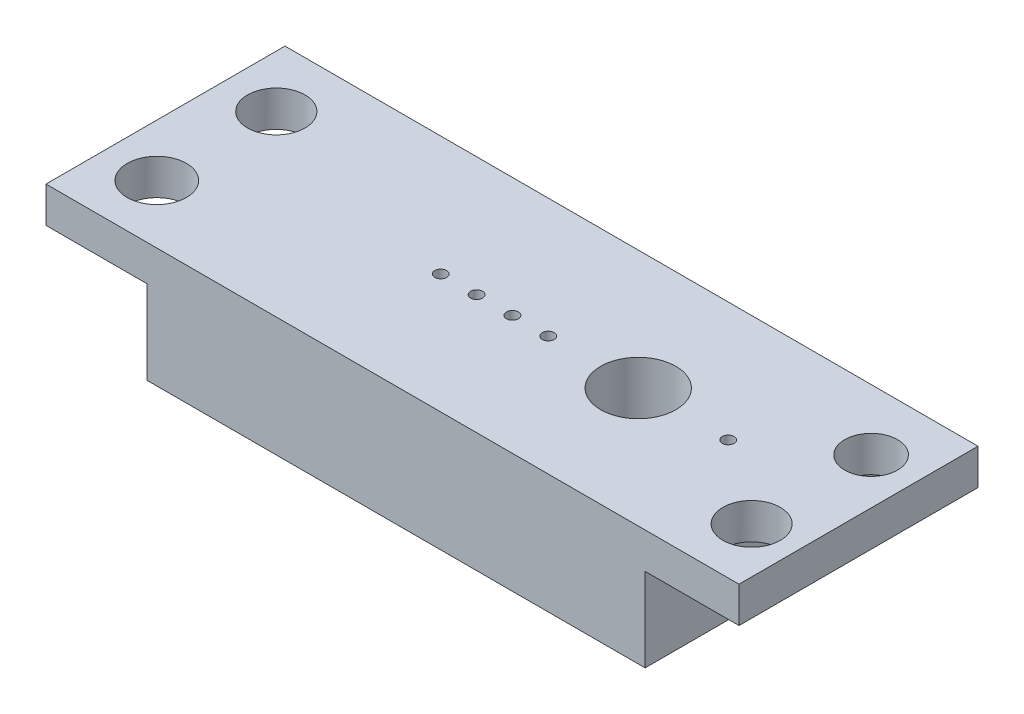
from build123d import *

# Parameters (mm, degrees)
SKETCH1_W           = 58
SKETCH1_H           = 20
BOSS_EXTRUDE1_DEPTH = 3
SKETCH2_R           = 2.210718461
SKETCH2_R_2         = 2.399764385
SKETCH2_R_3         = 2.478849081
SKETCH2_R_4         = 2.403854655
CUT_EXTRUDE1_DEPTH  = 10
SKETCH3_W           = 41.706821958
SKETCH3_H           = 20
BOSS_EXTRUDE2_DEPTH = 7
SKETCH4_R           = 3.15
CUT_EXTRUDE2_DEPTH  = 20
SKETCH5_R           = 0.5
CUT_EXTRUDE3_DEPTH  = 22


with BuildPart() as part:
    # Sketch1 → Boss-Extrude1 (new body)
    with BuildSketch(Plane(origin=(0, 0, 0), x_dir=(1, 0, 0), z_dir=(0, 1, 0))):
        with Locations((29, 10)):
            Rectangle(SKETCH1_W, SKETCH1_H)
    extrude(amount=BOSS_EXTRUDE1_DEPTH)

    # Sketch2 → Cut-Extrude1 (cut)
    with BuildSketch(Plane(origin=(0, 3, 0), x_dir=(1, 0, 0), z_dir=(0, 1, 0))):
        with Locations(Location((54.154962959, 14.898762514, 0), (0, 0, 270))):
            Circle(SKETCH2_R)
        with Locations(Location((54.154962959, 4.898762514, 0), (0, 0, 270))):
            Circle(SKETCH2_R_2)
        with Locations(Location((4.375736357, 4.898762514, 0), (0, 0, 270))):
            Circle(SKETCH2_R_3)
        with Locations(Location((4.375736357, 14.898762514, 0), (0, 0, 270))):
            Circle(SKETCH2_R_4)
    extrude(amount=-CUT_EXTRUDE1_DEPTH, mode=Mode.SUBTRACT)

    # Sketch3 → Boss-Extrude2 (add)
    with BuildSketch(Plane.XZ):
        with Locations((29.286245635, -10)):
            Rectangle(SKETCH3_W, SKETCH3_H)
    extrude(amount=BOSS_EXTRUDE2_DEPTH)

    # Sketch4 → Cut-Extrude2 (cut)
    with BuildSketch(Plane(origin=(0, 3, 0), x_dir=(1, 0, 0), z_dir=(0, 1, 0))):
        with Locations(Location((39.565349658, 10, 0), (0, 0, 270))):
            Circle(SKETCH4_R)
    extrude(amount=-CUT_EXTRUDE2_DEPTH, mode=Mode.SUBTRACT)

    # Sketch5 → Cut-Extrude3 (cut)
    with BuildSketch(Plane.XZ.offset(7)):
        with Locations(Location((26.035349658, -10, 0), (0, 0, 270))):
            Circle(SKETCH5_R)
        with Locations(Location((29.035349658, -10, 0), (0, 0, 270))):
            Circle(SKETCH5_R)
        with Locations(Location((23.035349658, -10, 0), (0, 0, 270))):
            Circle(SKETCH5_R)
        with Locations(Location((32.035349658, -10, 0), (0, 0, 270))):
            Circle(SKETCH5_R)
        with Locations(Location((47.095349658, -10, 0), (0, 0, 270))):
            Circle(SKETCH5_R)
    extrude(amount=-CUT_EXTRUDE3_DEPTH, mode=Mode.SUBTRACT)


solid = part.part
